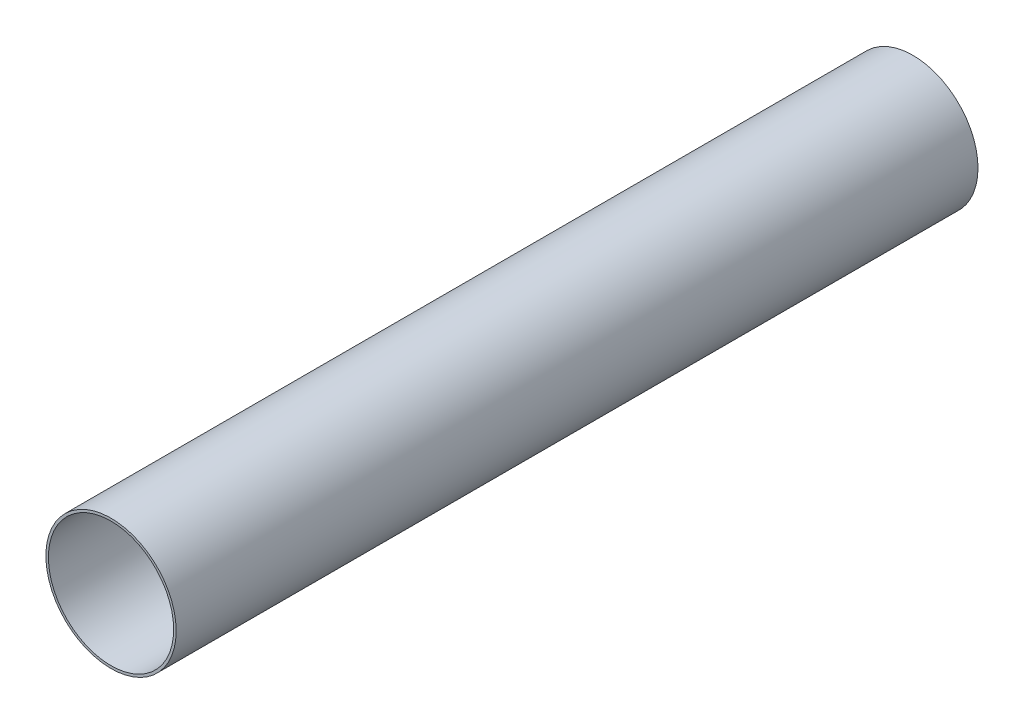
from build123d import *

# Parameters (mm, degrees)
SKETCH2_R           = 13
SKETCH2_R_2         = 12.5
BOSS_EXTRUDE1_DEPTH = 160


with BuildPart() as part:
    # Sketch2 → Boss-Extrude1 (new body)
    with BuildSketch(Plane.XY):
        Circle(SKETCH2_R)
        Circle(SKETCH2_R_2, mode=Mode.SUBTRACT)
    extrude(amount=BOSS_EXTRUDE1_DEPTH)


solid = part.part
